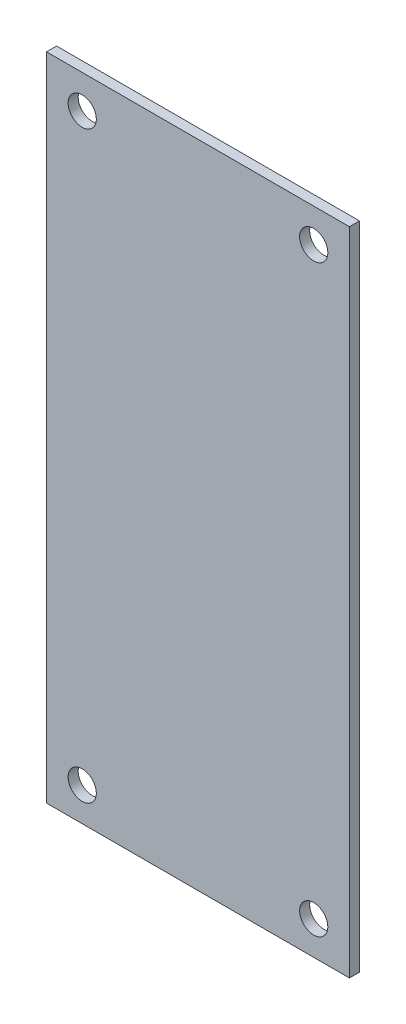
from build123d import *

# Parameters (mm, degrees)
CROQUIS1_W              = 30.1
CROQUIS1_H              = 64.643
CROQUIS1_R              = 1.4
SALIENTE_EXTRUIR1_DEPTH = 1


with BuildPart() as part:
    # Croquis1 → Saliente-Extruir1 (new body)
    with BuildSketch(Plane.XY):
        Rectangle(CROQUIS1_W, CROQUIS1_H)
        with Locations((-11.5, -29)):
            Circle(CROQUIS1_R, mode=Mode.SUBTRACT)
        with Locations((11.5, -29)):
            Circle(CROQUIS1_R, mode=Mode.SUBTRACT)
        with Locations(Location((11.5, 29, 0), (0, 0, 180))):
            Circle(CROQUIS1_R, mode=Mode.SUBTRACT)
        with Locations(Location((-11.5, 29, 0), (0, 0, 180))):
            Circle(CROQUIS1_R, mode=Mode.SUBTRACT)
    extrude(amount=SALIENTE_EXTRUIR1_DEPTH)


solid = part.part
